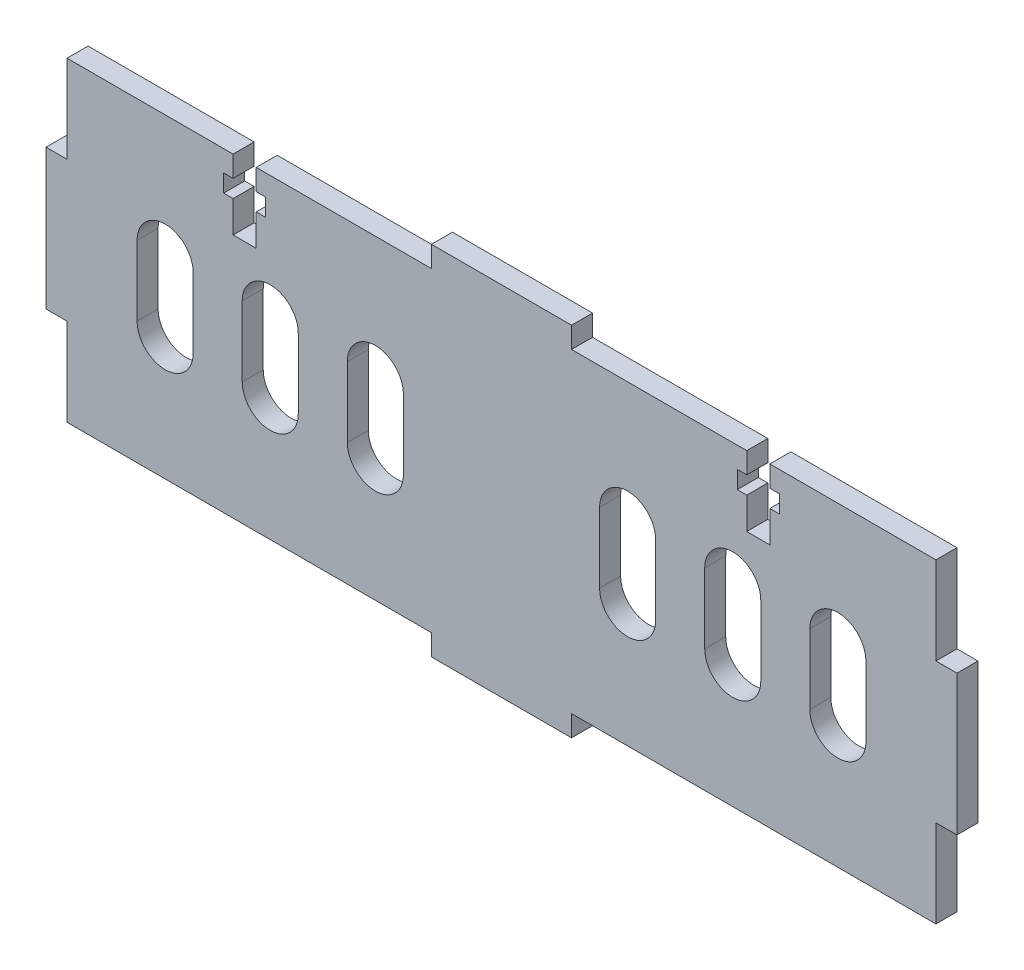
from build123d import *

# Parameters (mm, degrees)
SKETCH1_W           = 3
SKETCH1_H           = 20
SKETCH1_W_2         = 20
SKETCH1_H_2         = 3
BOSS_EXTRUDE1_DEPTH = 3


with BuildPart() as part:
    # Sketch1 → Boss-Extrude1 (new body)
    # profile 1 of 5: a face of its own
    with BuildSketch(Plane.XY):
        with Locations((-63.5, 0)):
            Rectangle(SKETCH1_W, SKETCH1_H)
    # profile 2 of 5: a face of its own
    with BuildSketch(Plane.XY):
        Polygon((10, -22.5), (62, -22.5), (62, -10), (62, 10), (62, 22.5), (38.3, 22.5), (38.3, 19.5), (39.65, 19.5), (39.65, 17), (38.3, 17), (38.3, 12.5), (35, 12.5), (35, 17), (33.65, 17), (33.65, 19.5), (35, 19.5), (35, 22.5), (10, 22.5), (-10, 22.5), (-35, 22.5), (-35, 19.5), (-33.65, 19.5), (-33.65, 17), (-35, 17), (-35, 12.5), (-38.3, 12.5), (-38.3, 17), (-39.65, 17), (-39.65, 19.5), (-38.3, 19.5), (-38.3, 22.5), (-62, 22.5), (-62, 10), (-62, -10), (-62, -22.5), (-10, -22.5), align=None)
        with BuildLine():
            ThreePointArc((-44, -5), (-48, -9), (-52, -5))
            Line((-52, -5), (-52, 5))
            ThreePointArc((-52, 5), (-48, 9), (-44, 5))
            Line((-44, 5), (-44, -5))
        make_face(mode=Mode.SUBTRACT)
        with BuildLine():
            ThreePointArc((-29, -5), (-33, -9), (-37, -5))
            Line((-37, -5), (-37, 5))
            ThreePointArc((-37, 5), (-33, 9), (-29, 5))
            Line((-29, 5), (-29, -5))
        make_face(mode=Mode.SUBTRACT)
        with BuildLine():
            ThreePointArc((-14, -5), (-18, -9), (-22, -5))
            Line((-22, -5), (-22, 5))
            ThreePointArc((-22, 5), (-18, 9), (-14, 5))
            Line((-14, 5), (-14, -5))
        make_face(mode=Mode.SUBTRACT)
        with BuildLine():
            Line((22, 5), (22, -5))
            ThreePointArc((22, -5), (18, -9), (14, -5))
            Line((14, -5), (14, 5))
            ThreePointArc((14, 5), (18, 9), (22, 5))
        make_face(mode=Mode.SUBTRACT)
        with BuildLine():
            Line((37, 5), (37, -5))
            ThreePointArc((37, -5), (33, -9), (29, -5))
            Line((29, -5), (29, 5))
            ThreePointArc((29, 5), (33, 9), (37, 5))
        make_face(mode=Mode.SUBTRACT)
        with BuildLine():
            Line((52, 5), (52, -5))
            ThreePointArc((52, -5), (48, -9), (44, -5))
            Line((44, -5), (44, 5))
            ThreePointArc((44, 5), (48, 9), (52, 5))
        make_face(mode=Mode.SUBTRACT)
    # profile 3 of 5: a face of its own
    with BuildSketch(Plane.XY):
        with Locations((0, 24)):
            Rectangle(SKETCH1_W_2, SKETCH1_H_2)
    # profile 4 of 5: a face of its own
    with BuildSketch(Plane.XY):
        with Locations((63.5, 0)):
            Rectangle(SKETCH1_W, SKETCH1_H)
    # profile 5 of 5: a face of its own
    with BuildSketch(Plane.XY):
        with Locations((0, -24)):
            Rectangle(SKETCH1_W_2, SKETCH1_H_2)
    extrude(amount=BOSS_EXTRUDE1_DEPTH)


solid = part.part
